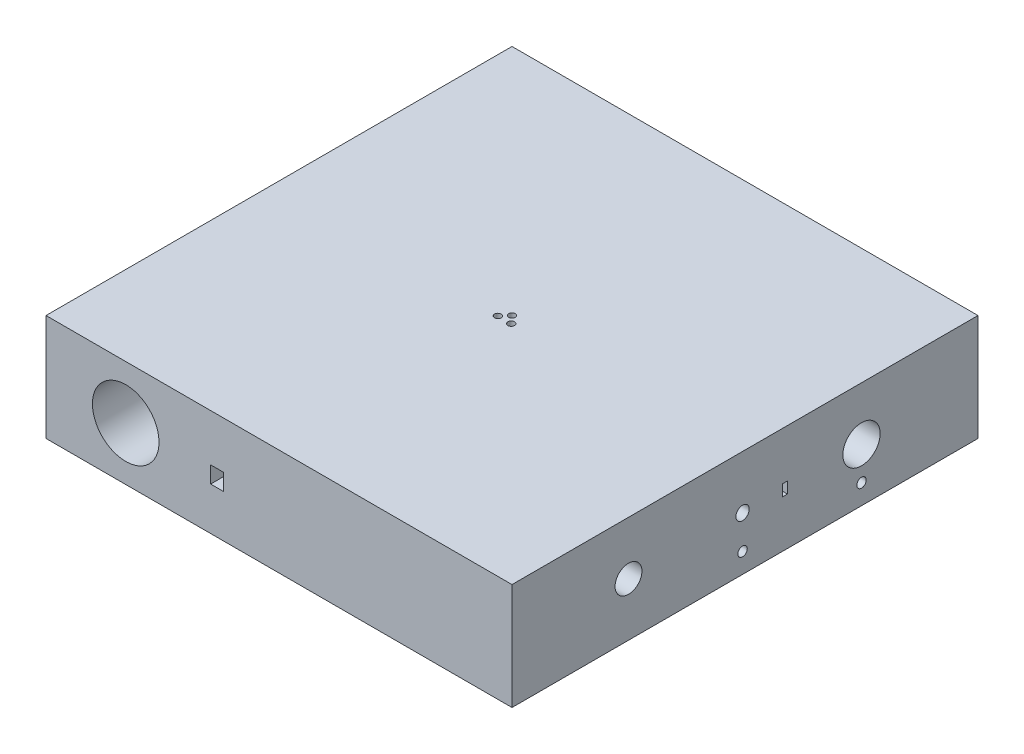
from build123d import *

# Parameters (mm, degrees)
SKETCH1_W               = 350
SKETCH1_H               = 350
BOSS_EXTRUDE1_DEPTH     = 80
CUT_EXTRUDE1_DEPTH      = 261.096136073
SKETCH2_4_R             = 2.5
CUT_EXTRUDE2_DEPTH      = 261.096136073
SKETCH2_5_R             = 2.5
CUT_EXTRUDE3_DEPTH      = 261.096136073
SKETCH3_W               = 3.7
SKETCH3_H               = 8.5
CUT_EXTRUDE4_DEPTH      = 400.405808671
SKETCH4_R               = 10.1
CUT_EXTRUDE5_DEPTH      = 400.405808671
CUT_EXTRUDE7_DEPTH      = 10
CUT_EXTRUDE7_DEPTH_BACK = 400.405808671
SKETCH6_R               = 3.555
SKETCH7_R               = 3.555
CUT_EXTRUDE8_DEPTH      = 400.405808778
SKETCH9_R               = 14
CUT_EXTRUDE10_DEPTH     = 400.405808778
SKETCH11_R              = 5.025
CUT_EXTRUDE12_DEPTH     = 400.405808778
SKETCH13_R              = 25
CUT_EXTRUDE14_DEPTH     = 400.405808735
SKETCH14_W              = 9.7
SKETCH14_H              = 12.5
CUT_EXTRUDE18_DEPTH     = 400.405808822


with BuildPart() as part:
    # Sketch1 → Boss-Extrude1 (new body)
    with BuildSketch(Plane(origin=(0, 0, 0), x_dir=(1, 0, 0), z_dir=(0, 1, 0))):
        Rectangle(SKETCH1_W, SKETCH1_H)
    extrude(amount=BOSS_EXTRUDE1_DEPTH)

    # Sketch2 → Cut-Extrude1 (cut, through all)
    with BuildSketch(Plane(origin=(0, 80, 0), x_dir=(1, 0, 0), z_dir=(0, 1, 0))):
        with BuildLine():
            ThreePointArc((0, 2.5), (-1.767766953, -1.767766953), (2.5, 0))
            ThreePointArc((2.5, 0), (1.767766953, 1.767766953), (0, 2.5))
        make_face()
    extrude(amount=-CUT_EXTRUDE1_DEPTH, mode=Mode.SUBTRACT)

    # Sketch2<4> → Cut-Extrude2 (cut, through all)
    with BuildSketch(Plane(origin=(0, 80, 0), x_dir=(1, 0, 0), z_dir=(0, 1, 0))):
        with Locations((5, -5.590169944)):
            Circle(SKETCH2_4_R)
    extrude(amount=-CUT_EXTRUDE2_DEPTH, mode=Mode.SUBTRACT)

    # Sketch2<5> → Cut-Extrude3 (cut, through all)
    with BuildSketch(Plane(origin=(0, 80, 0), x_dir=(1, 0, 0), z_dir=(0, 1, 0))):
        with Locations((-5, -5.590169944)):
            Circle(SKETCH2_5_R)
    extrude(amount=-CUT_EXTRUDE3_DEPTH, mode=Mode.SUBTRACT)

    # Sketch3 → Cut-Extrude4 (cut, through all)
    with BuildSketch(Plane.ZY.offset(175)):
        with Locations((-30, 39.681610839)):
            Rectangle(SKETCH3_W, SKETCH3_H)
    extrude(amount=-CUT_EXTRUDE4_DEPTH, mode=Mode.SUBTRACT)

    # Sketch4 → Cut-Extrude5 (cut, through all)
    with BuildSketch(Plane.ZY.offset(175)):
        with Locations((87.5, 40)):
            Circle(SKETCH4_R)
    extrude(amount=-CUT_EXTRUDE5_DEPTH, mode=Mode.SUBTRACT)

    # Sketch6 → Cut-Extrude7 (cut, two sides: drawn at the far end of the back side and taken through both)
    with BuildSketch(Plane.ZY.offset(175).offset(-CUT_EXTRUDE7_DEPTH_BACK)):
        with Locations((1.85, 15)):
            Circle(SKETCH6_R)
    extrude(amount=CUT_EXTRUDE7_DEPTH + CUT_EXTRUDE7_DEPTH_BACK, mode=Mode.SUBTRACT)

    # Sketch7 → Cut-Extrude8 (cut, through all)
    with BuildSketch(Plane.ZY.offset(175)):
        with Locations((-87.5, 15)):
            Circle(SKETCH7_R)
    extrude(amount=-CUT_EXTRUDE8_DEPTH, mode=Mode.SUBTRACT)

    # Sketch9 → Cut-Extrude10 (cut, through all)
    with BuildSketch(Plane.ZY.offset(175)):
        with Locations((-87.5, 40)):
            Circle(SKETCH9_R)
    extrude(amount=-CUT_EXTRUDE10_DEPTH, mode=Mode.SUBTRACT)

    # Sketch11 → Cut-Extrude12 (cut, through all)
    with BuildSketch(Plane.ZY.offset(175)):
        with Locations((1.85, 40)):
            Circle(SKETCH11_R)
    extrude(amount=-CUT_EXTRUDE12_DEPTH, mode=Mode.SUBTRACT)

    # Sketch13 → Cut-Extrude14 (cut, through all)
    with BuildSketch(Plane(origin=(0, 0, -175), x_dir=(-1, 0, 0), z_dir=(0, 0, -1))):
        with Locations((115.112005789, 40)):
            Circle(SKETCH13_R)
    extrude(amount=-CUT_EXTRUDE14_DEPTH, mode=Mode.SUBTRACT)

    # Sketch14 → Cut-Extrude18 (cut, through all)
    with BuildSketch(Plane(origin=(0, 0, -175), x_dir=(-1, 0, 0), z_dir=(0, 0, -1))):
        with Locations((46.47975887, 38.444138081)):
            Rectangle(SKETCH14_W, SKETCH14_H)
    extrude(amount=-CUT_EXTRUDE18_DEPTH, mode=Mode.SUBTRACT)


solid = part.part
